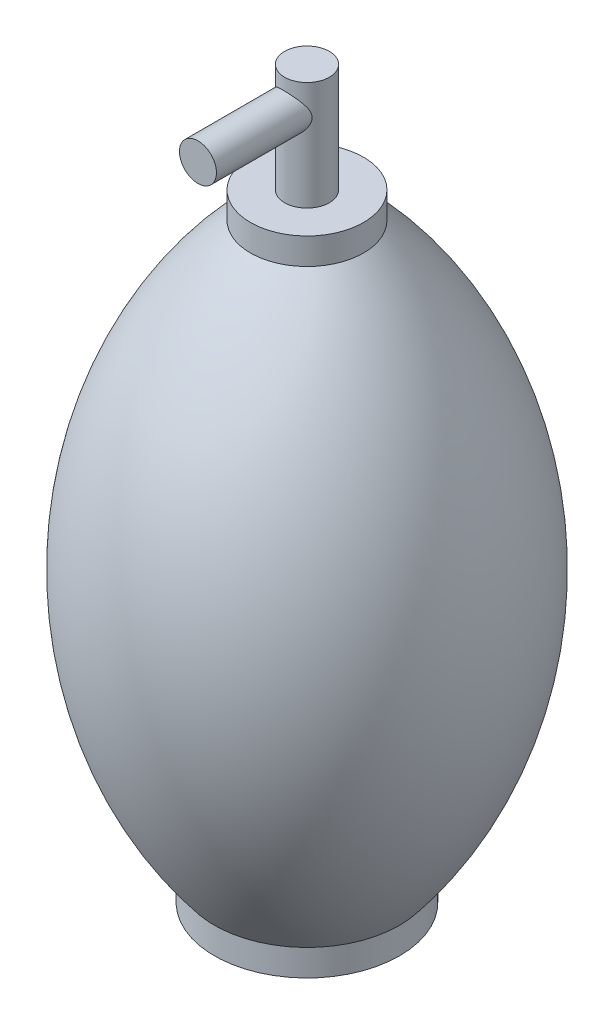
from build123d import *

# Parameters (mm, degrees)
SKETCH2_R           = 7.621417702
BOSS_EXTRUDE1_DEPTH = 37
SKETCH3_R           = 6.301348683
BOSS_EXTRUDE2_DEPTH = 37


with BuildPart() as part:
    # Sketch1 → Revolve1 (revolve)
    with BuildSketch(Plane.XY, mode=Mode.PRIVATE) as revolve1_sk:
        with BuildLine():
            Line((-13.94213087, 14.118857143), (-33.19213087, 14.118857143))
            Line((-33.19213087, 14.118857143), (-33.19213087, 5.118857143))
            Line((-33.19213087, 5.118857143), (-33.19213087, -186.881142857))
            Line((-33.19213087, -186.881142857), (-33.19213087, -195.881142857))
            Line((-33.19213087, -195.881142857), (-1.69213087, -195.881142857))
            Line((-1.69213087, -195.881142857), (-1.69213087, -186.881142857))
            ThreePointArc((-1.69213087, -186.881142857), (29.176808752, -88.520852439), (-13.94213087, 5.118857143))
            Line((-13.94213087, 5.118857143), (-13.94213087, 14.118857143))
        make_face()
    revolve(revolve1_sk.sketch.rotate(Axis((-33.19213087, 5.118857143, 0), (0, -1, 0)), 180), axis=Axis((-33.19213087, 5.118857143, 0), (0, -1, 0)))

    # Sketch2 → Boss-Extrude1 (add)
    with BuildSketch(Plane(origin=(0, 14.118857143, 0), x_dir=(1, 0, 0), z_dir=(0, 1, 0))):
        with Locations(Location((-33.19213087, 0, 0), (0, 0, 180))):
            Circle(SKETCH2_R)
    extrude(amount=BOSS_EXTRUDE1_DEPTH)

    # Sketch3 → Boss-Extrude2 (add)
    with BuildSketch(Plane.XY):
        with Locations(Location((-33.305381498, 40.717884654, 0), (0, 0, 180))):
            Circle(SKETCH3_R)
    extrude(amount=BOSS_EXTRUDE2_DEPTH)


solid = part.part
